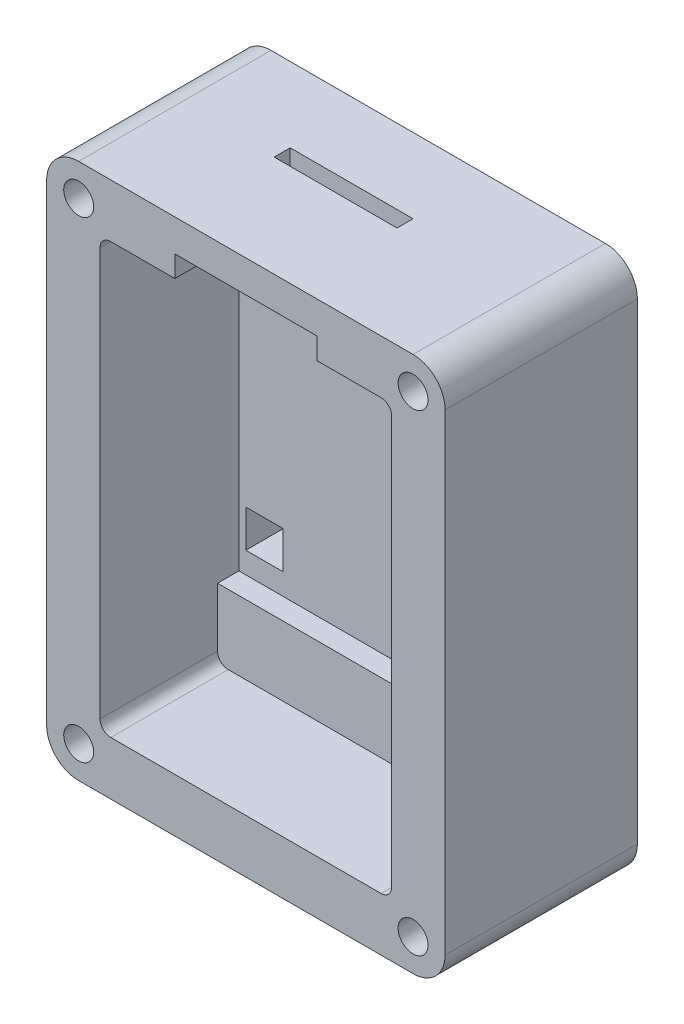
from build123d import *

# Parameters (mm, degrees)
SKETCH_1_W          = 37.3
SKETCH_1_H          = 50.2
SKETCH_1_W_2        = 27.3
SKETCH_1_H_2        = 40.2
EXTRUDE_1_DEPTH     = 18
SKETCH_1_2_W        = 27.3
SKETCH_1_2_H        = 40.2
EXTRUDE_2_DEPTH     = 2
SKETCH_2_R          = 4.2
CUT_EXTRUDE_2_DEPTH = 37.080916008
SKETCH_3_W          = 3.5
SKETCH_3_H          = 3.5
CUT_EXTRUDE_3_DEPTH = 36.125951944
SKETCH_4_W          = 8.5
SKETCH_4_H          = 9.2
SKETCH_4_W_2        = 3.5
SKETCH_4_H_2        = 3.5
EXTRUDE_3_DEPTH     = 3
SKETCH_5_W          = 27.3
SKETCH_5_H          = 6.5
EXTRUDE_4_DEPTH     = 2
SKETCH_6_W          = 11.5
SKETCH_6_H          = 1.5
CUT_EXTRUDE_4_DEPTH = 10
FILLET_1_R          = 1
FILLET_2_R          = 3
SKETCH_7_R          = 1.4
CUT_EXTRUDE_5_DEPTH = 10
CUT_EXTRUDE_6_REACH = 38.081
SKETCH_8_W          = 13.3
SKETCH_8_H          = 4


with BuildPart() as part:
    # 스케치1 → 보스-돌출1 (new body)
    with BuildSketch(Plane.XY):
        Rectangle(SKETCH_1_W, SKETCH_1_H)
        Rectangle(SKETCH_1_W_2, SKETCH_1_H_2, mode=Mode.SUBTRACT)
    extrude(amount=EXTRUDE_1_DEPTH)

    # 스케치1<2> → 보스-돌출2 (add)
    with BuildSketch(Plane.XY):
        Rectangle(SKETCH_1_2_W, SKETCH_1_2_H)
    extrude(amount=EXTRUDE_2_DEPTH)

    # 스케치2 → 컷-돌출2 (cut, through all)
    with BuildSketch(Plane.XY):
        with Locations((0, 11.9)):
            Circle(SKETCH_2_R)
    extrude(amount=CUT_EXTRUDE_2_DEPTH, mode=Mode.SUBTRACT)

    # 스케치3 → 컷-돌출3 (cut, through all)
    with BuildSketch(Plane.XY.offset(2)):
        with Locations((-11.25, -9.85)):
            Rectangle(SKETCH_3_W, SKETCH_3_H)
    extrude(amount=-CUT_EXTRUDE_3_DEPTH, mode=Mode.SUBTRACT)

    # 스케치4 → 보스-돌출3 (add)
    with BuildSketch(Plane.XY.offset(2)):
        Polygon((-13.65, -20.1), (13.65, -20.1), (13.65, 20.1), (4.25, 20.1), (-4.25, 20.1), (-13.65, 20.1), align=None)
        with Locations((0, 12)):
            Rectangle(SKETCH_4_W, SKETCH_4_H, mode=Mode.SUBTRACT)
        with Locations((-11.25, -9.85)):
            Rectangle(SKETCH_4_W_2, SKETCH_4_H_2, mode=Mode.SUBTRACT)
    extrude(amount=EXTRUDE_3_DEPTH)

    # 스케치5 → 보스-돌출4 (add)
    with BuildSketch(Plane.XY.offset(5)):
        with Locations((0, -16.85)):
            Rectangle(SKETCH_5_W, SKETCH_5_H)
    extrude(amount=EXTRUDE_4_DEPTH)

    # 스케치6 → 컷-돌출4 (cut)
    with BuildSketch(Plane(origin=(0, 25.1, 0), x_dir=(1, 0, 0), z_dir=(0, 1, 0))):
        with Locations((-1.1, -7.75)):
            Rectangle(SKETCH_6_W, SKETCH_6_H)
    extrude(amount=-CUT_EXTRUDE_4_DEPTH, mode=Mode.SUBTRACT)

    # 필렛1
    fillet_1_edges = [part.edges().sort_by_distance(p)[0] for p in [
        (13.65, -20.1, 12.5),
        (13.65, 20.1, 11.5),
        (-13.65, 20.1, 11.5),
        (-13.65, -20.1, 12.5),
    ]]
    fillet(fillet_1_edges, radius=FILLET_1_R)

    # 필렛2
    fillet_2_edges = [part.edges().sort_by_distance(p)[0] for p in [
        (18.65, -25.1, 9),
        (-18.65, -25.1, 9),
        (-18.65, 25.1, 9),
        (18.65, 25.1, 9),
    ]]
    fillet(fillet_2_edges, radius=FILLET_2_R)

    # 스케치7 → 컷-돌출5 (cut)
    with BuildSketch(Plane.XY.offset(18)):
        with Locations((-15.65, 22.1)):
            Circle(SKETCH_7_R)
        with Locations((15.65, 22.1)):
            Circle(SKETCH_7_R)
        with Locations((-15.65, -22.1)):
            Circle(SKETCH_7_R)
        with Locations((15.65, -22.1)):
            Circle(SKETCH_7_R)
    extrude(amount=-CUT_EXTRUDE_5_DEPTH, mode=Mode.SUBTRACT)

    # 컷-돌출6: up to this face of the body (flat: up to its plane)
    cut_extrude_6_end = Plane(part.part.faces().sort_by_distance((-1.1, 22.6, 7))[0])
    # 스케치8 → 컷-돌출6 (cut, up to the picked face)
    with BuildSketch(Plane.XY.offset(18), mode=Mode.PRIVATE) as cut_extrude_6_sk1:
        with Locations((0, 20.1)):
            Rectangle(SKETCH_8_W, SKETCH_8_H)
    cut_extrude_6_tool1 = split(extrude(cut_extrude_6_sk1.sketch, amount=-CUT_EXTRUDE_6_REACH, mode=Mode.PRIVATE), bisect_by=cut_extrude_6_end, keep=Keep.BOTH, mode=Mode.PRIVATE)
    add(cut_extrude_6_tool1.solids().sort_by(Axis((0, 20.1, 18), (0, 0, -1)))[0], mode=Mode.SUBTRACT)


solid = part.part
